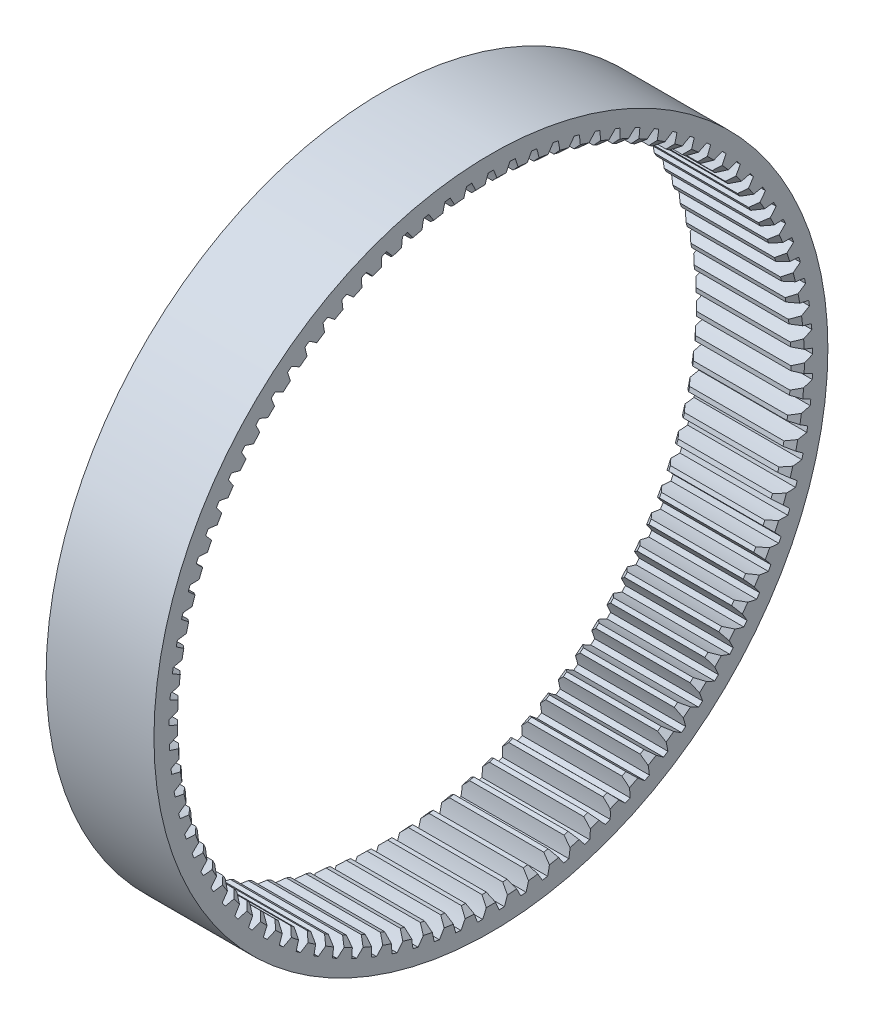
from build123d import *

# Parameters (mm, degrees)
BASPROSKE_W     = 8
BASPROSKE_H     = 2.25
TOOTHCUT_DEPTH  = 37.249137921
TEETHCUTS_COUNT = 93
TEETHCUTS_ANGLE = 356.129032258


with BuildPart() as part:
    # BasProSke → Base-Revolve (revolve)
    with BuildSketch(Plane(origin=(0, 0, 0), x_dir=(1, 0, 0), z_dir=(0, 1, 0)), mode=Mode.PRIVATE) as base_revolve_sk:
        with Locations((4, 23.875)):
            Rectangle(BASPROSKE_W, BASPROSKE_H)
    revolve(base_revolve_sk.sketch.rotate(Axis((-10, 0, 0), (1, 0, 0)), 180), axis=Axis((-10, 0, 0), (1, 0, 0)))

    # TooCutSke → ToothCut (cut, through all)
    with BuildSketch(Plane(origin=(0, 0, 0), x_dir=(0, 0, -1), z_dir=(1, 0, 0))):
        with BuildLine():
            ThreePointArc((0.615990529, 22.716249709), (0.420102037, 23.30134178), (0.193445829, 23.875216328))
            ThreePointArc((0.193445829, 23.875216328), (0, 23.876), (-0.193445829, 23.875216328))
            ThreePointArc((-0.193445829, 23.875216328), (-0.420102037, 23.30134178), (-0.615990529, 22.716249709))
            ThreePointArc((-0.615990529, 22.716249709), (0, 22.7246), (0.615990529, 22.716249709))
        make_face()
    toothcut = extrude(amount=TOOTHCUT_DEPTH, mode=Mode.SUBTRACT)

    # TeethCuts: ToothCut ×93 about axis
    teethcuts_axis = Axis((-10, 0, 0), (1, 0, 0))
    for i in range(1, TEETHCUTS_COUNT):
        add(toothcut.rotate(teethcuts_axis, i * TEETHCUTS_ANGLE / (TEETHCUTS_COUNT - 1)), mode=Mode.SUBTRACT)

    # Sketch2 → Cut-Revolve1 (revolve, cut)
    with BuildSketch(Plane.XY):
        Polygon((8, -23.25), (7.5, -22.75), (8, -22.75), align=None)
        Polygon((0, -22.75), (0, -23.25), (0.5, -22.75), align=None)
    revolve(axis=Axis((0, 0, 0), (-1, 0, 0)), mode=Mode.SUBTRACT)


solid = part.part
